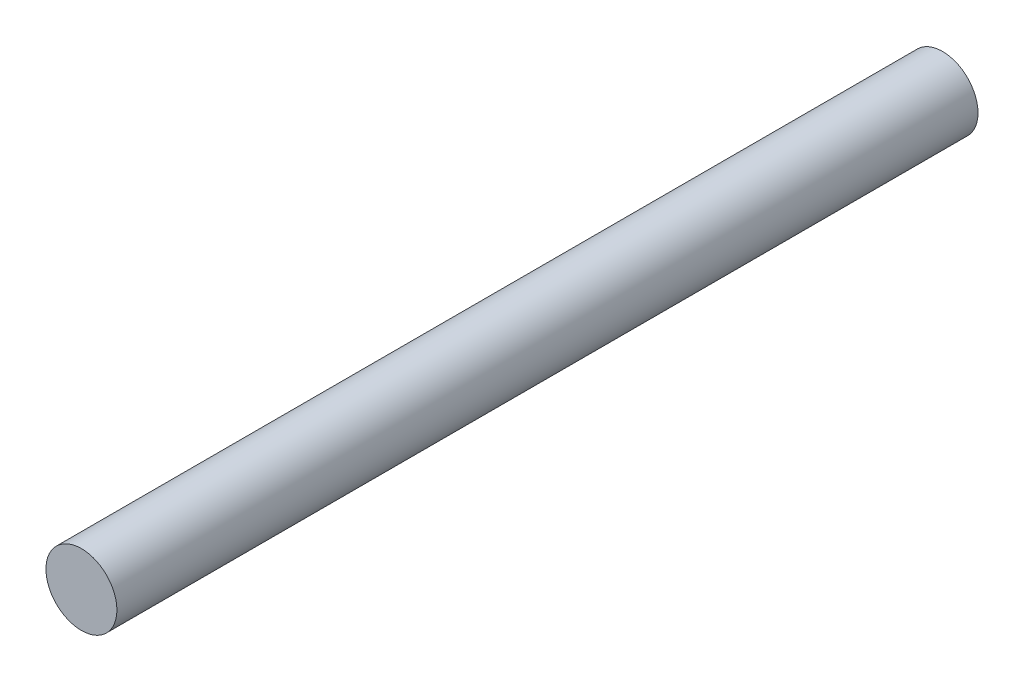
from build123d import *

# Parameters (mm, degrees)
SKETCH_2_R      = 0.75
EXTRUDE_1_DEPTH = 18.2


with BuildPart() as part:
    # 草图2 → 凸台-拉伸1 (new body)
    with BuildSketch(Plane.XY):
        Circle(SKETCH_2_R)
    extrude(amount=EXTRUDE_1_DEPTH)


solid = part.part
